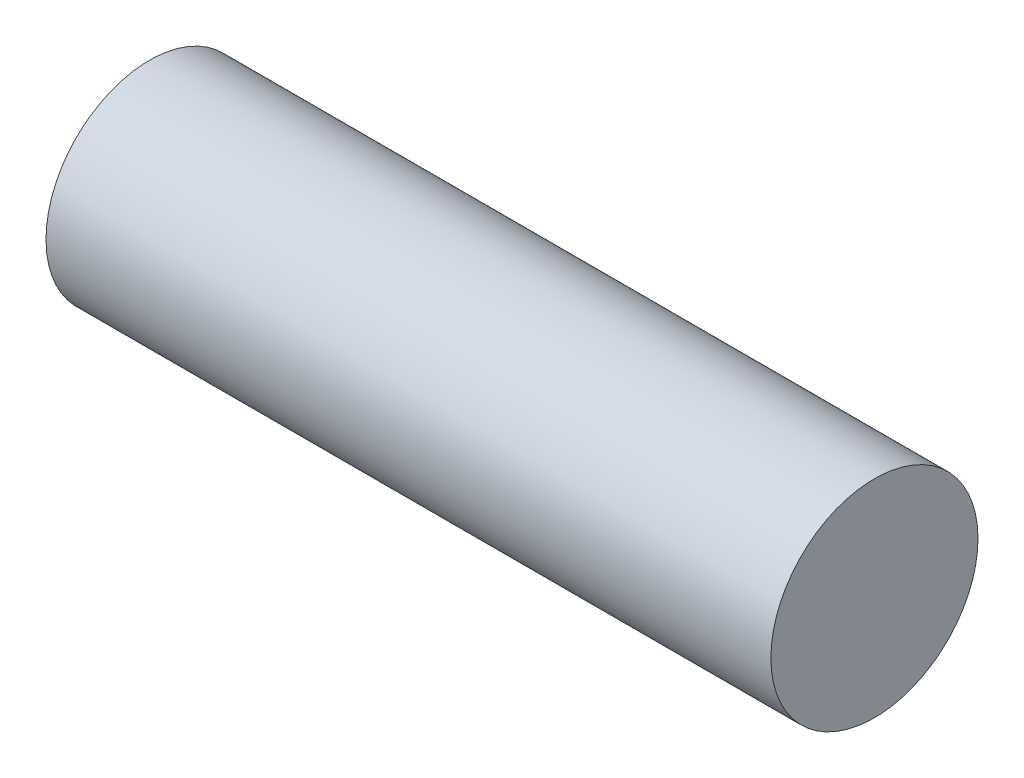
from build123d import *

# Parameters (mm, degrees)
SKETCH_1_R      = 2
EXTRUDE_1_DEPTH = 14


with BuildPart() as part:
    # 草图1 → 凸台-拉伸1 (new body)
    with BuildSketch(Plane(origin=(0, 0, 0), x_dir=(0, 0, -1), z_dir=(1, 0, 0))):
        Circle(SKETCH_1_R)
    extrude(amount=EXTRUDE_1_DEPTH)


solid = part.part
